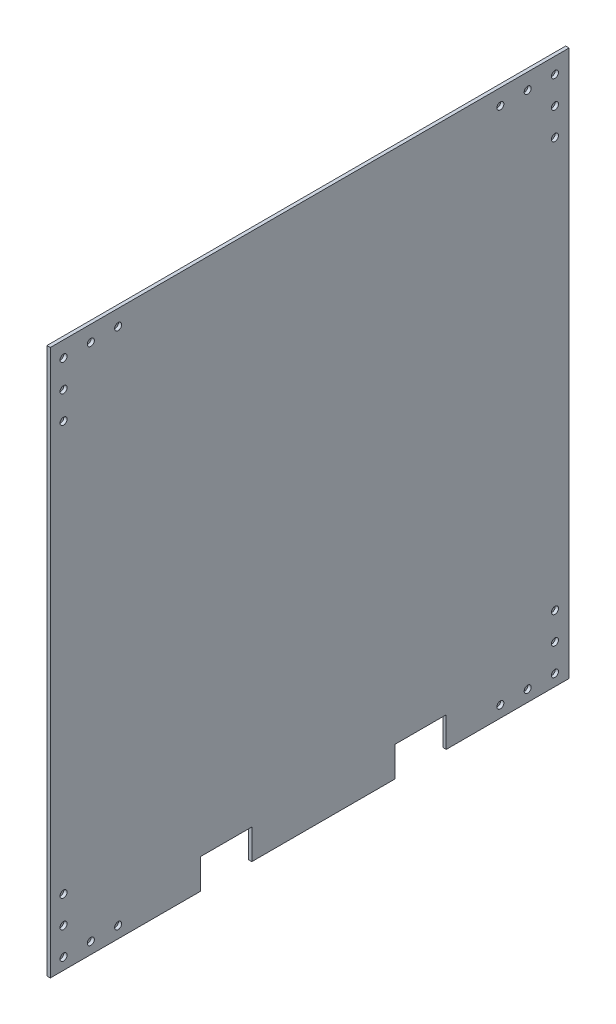
from build123d import *

# Parameters (mm, degrees)
SKETCH1_W           = 482.6
SKETCH1_H           = 508
BOSS_EXTRUDE1_DEPTH = 3.175
SKETCH2_W           = 47.752
SKETCH2_H           = 27.94
CUT_EXTRUDE1_DEPTH  = 1164.457101784
SKETCH3_R           = 3.263899997
SKETCH3_R_2         = 3.263900001
SKETCH3_R_3         = 3.263899999
SKETCH3_R_4         = 3.2639
CUT_EXTRUDE2_DEPTH  = 3


with BuildPart() as part:
    # Sketch1 → Boss-Extrude1 (new body)
    with BuildSketch(Plane(origin=(0, 0, 0), x_dir=(0, 0, -1), z_dir=(1, 0, 0))):
        with Locations((799.13388237, -266.691543511)):
            Rectangle(SKETCH1_W, SKETCH1_H)
    extrude(amount=BOSS_EXTRUDE1_DEPTH)

    # Sketch2 → Cut-Extrude1 (cut, through all)
    with BuildSketch(Plane(origin=(3.175, 0, 0), x_dir=(0, 0, -1), z_dir=(1, 0, 0))):
        with Locations((721.40988237, -506.721543511)):
            Rectangle(SKETCH2_W, SKETCH2_H)
        with Locations((902.25788237, -506.721543511)):
            Rectangle(SKETCH2_W, SKETCH2_H)
    extrude(amount=-CUT_EXTRUDE1_DEPTH, mode=Mode.SUBTRACT)

    # Sketch3 → Cut-Extrude2 (cut)
    with BuildSketch(Plane(origin=(3.175, 0, 0), x_dir=(0, 0, -1), z_dir=(1, 0, 0))):
        with Locations((570.11679197, -27.399401396)):
            Circle(SKETCH3_R)
        with Locations((595.516791968, -27.399401397)):
            Circle(SKETCH3_R_2)
        with Locations((620.916791968, -27.399401397)):
            Circle(SKETCH3_R_2)
        with Locations((570.116791968, -52.799401397)):
            Circle(SKETCH3_R_2)
        with Locations((570.116791967, -78.199401397)):
            Circle(SKETCH3_R_2)
        with Locations((570.116791968, -509.999401397)):
            Circle(SKETCH3_R_3)
        with Locations((570.116791967, -484.599401397)):
            Circle(SKETCH3_R_4)
        with Locations((570.116791967, -459.199401397)):
            Circle(SKETCH3_R_4)
        with Locations((595.516791967, -509.999401397)):
            Circle(SKETCH3_R_4)
        with Locations((620.916791967, -509.999401397)):
            Circle(SKETCH3_R_4)
        with Locations((1027.316791967, -509.999401397)):
            Circle(SKETCH3_R_4)
        with Locations((1001.916791967, -509.999401397)):
            Circle(SKETCH3_R_4)
        with Locations((976.516791967, -509.999401397)):
            Circle(SKETCH3_R_4)
        with Locations((1027.316791967, -459.199401397)):
            Circle(SKETCH3_R_4)
        with Locations((1027.316791967, -484.599401397)):
            Circle(SKETCH3_R_4)
        with Locations((1027.316791967, -27.399401397)):
            Circle(SKETCH3_R_4)
        with Locations((1001.916791967, -27.399401397)):
            Circle(SKETCH3_R_4)
        with Locations((976.516791967, -27.399401397)):
            Circle(SKETCH3_R_4)
        with Locations((1027.316791967, -52.799401397)):
            Circle(SKETCH3_R_4)
        with Locations((1027.316791967, -78.199401397)):
            Circle(SKETCH3_R_4)
    extrude(amount=-CUT_EXTRUDE2_DEPTH, mode=Mode.SUBTRACT)


solid = part.part
